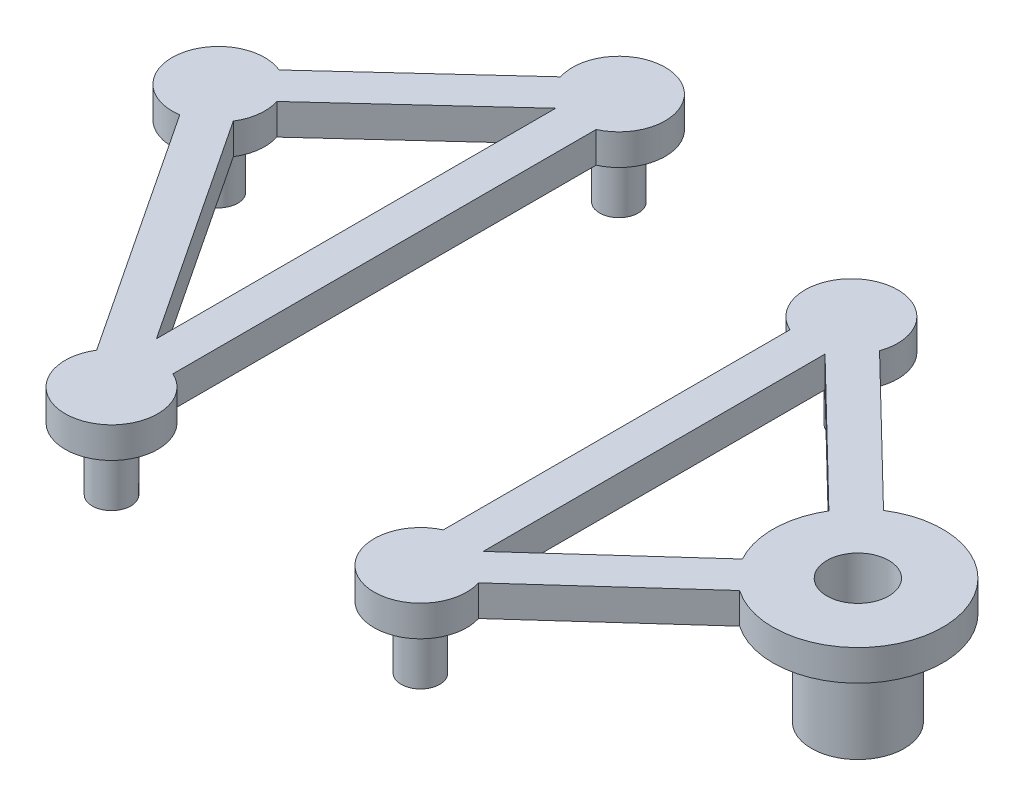
from build123d import *

# Parameters (mm, degrees)
EXTRUDE_1_DEPTH     = 4
EXTRUDE_1_2_DEPTH   = 4
SKETCH_2_R          = 2.5
EXTRUDE_2_DEPTH     = 8.1
SKETCH_3_R          = 2.5
EXTRUDE_3_DEPTH     = 8.1
SKETCH_4_R          = 6
EXTRUDE_4_DEPTH     = 12.1
SKETCH_5_R          = 4
CUT_EXTRUDE_1_DEPTH = 104.600515887


with BuildPart() as part:
    # Эскиз1 → Бобышка-Вытянуть1 (new body)
    with BuildSketch(Plane(origin=(0, 0, 0), x_dir=(1, 0, 0), z_dir=(0, 1, 0))):
        with BuildLine():
            Line((-64.701657296, 46.403150718), (-45.708049543, 63.851170528))
            ThreePointArc((-45.708049543, 63.851170528), (-37.586941576, 71.193373193), (-37.5, 60.245643943))
            Line((-37.5, 60.245643943), (-37.5, 5.454356057))
            ThreePointArc((-37.5, 5.454356057), (-38.272069955, -5.745803491), (-45.093798955, 3.170680085))
            Line((-45.093798955, 3.170680085), (-66.103993638, 34.943592009))
            ThreePointArc((-66.103993638, 34.943592009), (-72.98273861, 41.600945273), (-64.701657296, 46.403150718))
        make_face()
        with BuildLine():
            Line((-61.319115896, 42.72097559), (-42.5, 60.008702662))
            Line((-42.5, 60.008702662), (-42.5, 8.313130943))
            Line((-42.5, 8.313130943), (-61.933366483, 37.701466034))
            ThreePointArc((-61.933366483, 37.701466034), (-61.071592268, 40.143346965), (-61.319115896, 42.72097559))
        make_face(mode=Mode.SUBTRACT)
    extrude(amount=EXTRUDE_1_DEPTH)

    # Эскиз2 → Бобышка-Вытянуть2 (add)
    with BuildSketch(Plane.XZ):
        with Locations(Location((-40, 0, 0), (0, 0, 270))):
            Circle(SKETCH_2_R)
        with Locations(Location((-40, -65.7, 0), (0, 0, 270))):
            Circle(SKETCH_2_R)
        with Locations(Location((-67.027165439, -40.872146119, 0), (0, 0, 270))):
            Circle(SKETCH_2_R)
    extrude(amount=EXTRUDE_2_DEPTH)


with BuildPart() as body_2:
    # Эскиз1 → Extrude 1 2 (new body)
    with BuildSketch(Plane(origin=(0, 0, 0), x_dir=(1, 0, 0), z_dir=(0, 1, 0))):
        with BuildLine():
            Line((-2.5, 50.345643943), (-2.5, 5.454356057))
            ThreePointArc((-2.5, 5.454356057), (-2.436350888, -5.483082559), (5.723536854, 1.800312716))
            Line((5.723536854, 1.800312716), (23.485802209, 17.841335562))
            ThreePointArc((23.485802209, 17.841335562), (40.75840018, 26.67494221), (23.820802166, 36.135017294))
            Line((23.820802166, 36.135017294), (5.653785721, 53.791341986))
            ThreePointArc((5.653785721, 53.791341986), (-2.335551293, 61.326771223), (-2.5, 50.345643943))
        make_face()
        with BuildLine():
            Line((20.134637111, 21.55208919), (2.5, 5.626326843))
            Line((2.5, 5.626326843), (2.5, 49.884082804))
            Line((2.5, 49.884082804), (20.336024345, 32.549445717))
            ThreePointArc((20.336024345, 32.549445717), (18.762088009, 27.077745962), (20.134637111, 21.55208919))
        make_face(mode=Mode.SUBTRACT)
    extrude(amount=EXTRUDE_1_2_DEPTH)

    # Эскиз3 → Бобышка-Вытянуть3 (add)
    with BuildSketch(Plane.XZ):
        with Locations(Location((0, 0, 0), (0, 0, 90))):
            Circle(SKETCH_3_R)
        with Locations(Location((0, -55.8, 0), (0, 0, 90))):
            Circle(SKETCH_3_R)
    extrude(amount=EXTRUDE_3_DEPTH)

    # Эскиз4 → Бобышка-Вытянуть4 (add)
    with BuildSketch(Plane.XZ):
        with Locations(Location((29.760244095, -26.876344086, 0), (0, 0, 90))):
            Circle(SKETCH_4_R)
    extrude(amount=EXTRUDE_4_DEPTH)

    # Эскиз5 → Вырез-Вытянуть1 (cut, through all)
    with BuildSketch(Plane(origin=(0, 4, 0), x_dir=(1, 0, 0), z_dir=(0, 1, 0))):
        with Locations(Location((29.760244095, 26.876344086, 0), (0, 0, 270))):
            Circle(SKETCH_5_R)
    extrude(amount=-CUT_EXTRUDE_1_DEPTH, mode=Mode.SUBTRACT)


solid = Compound([part.part, body_2.part])
